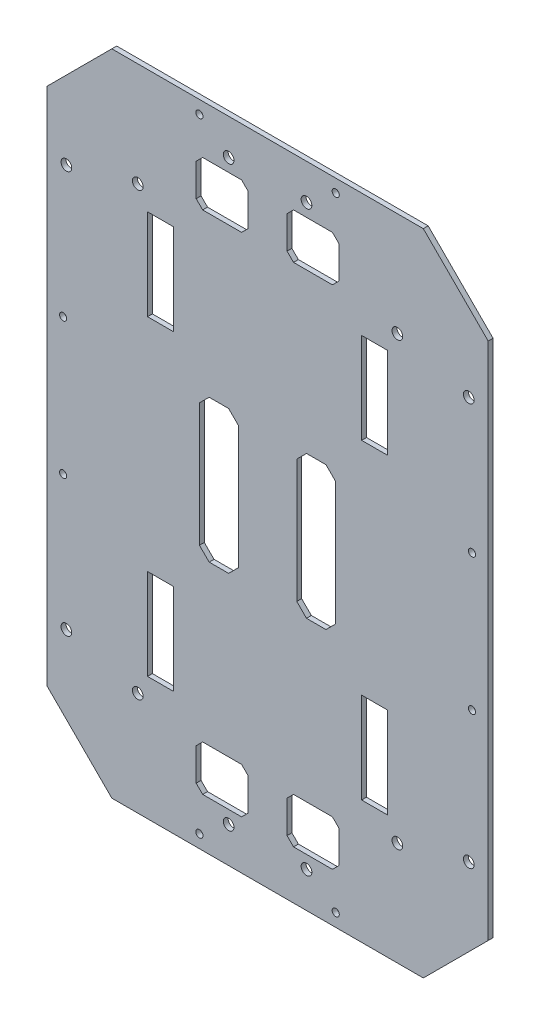
from build123d import *

# Parameters (mm, degrees)
SKETCH_1_R            = 1.65
SKETCH_1_W            = 8
SKETCH_1_H            = 28
EXTRUDE_401_DEPTH     = 1.5
SKETCH_3_R            = 1.1
CUT_EXTRUDE_482_DEPTH = 1.5


with BuildPart() as part:
    # 草图1 → Extrude 401 (new body)
    with BuildSketch(Plane.XY):
        Polygon((68, 80), (48, 100), (-48, 100), (-68, 80), (-68, -80), (-48, -100), (48, -100), (68, -80), align=None)
        with Locations((-62, -62)):
            Circle(SKETCH_1_R, mode=Mode.SUBTRACT)
        with Locations((-40, -68)):
            Circle(SKETCH_1_R, mode=Mode.SUBTRACT)
        with Locations((-12, -89)):
            Circle(SKETCH_1_R, mode=Mode.SUBTRACT)
        with Locations((-62, 62)):
            Circle(SKETCH_1_R, mode=Mode.SUBTRACT)
        with Locations((-40, 68)):
            Circle(SKETCH_1_R, mode=Mode.SUBTRACT)
        with Locations((-12, 89)):
            Circle(SKETCH_1_R, mode=Mode.SUBTRACT)
        with Locations((62, -62)):
            Circle(SKETCH_1_R, mode=Mode.SUBTRACT)
        with Locations((40, -68)):
            Circle(SKETCH_1_R, mode=Mode.SUBTRACT)
        with Locations((12, -89)):
            Circle(SKETCH_1_R, mode=Mode.SUBTRACT)
        with Locations((62, 62)):
            Circle(SKETCH_1_R, mode=Mode.SUBTRACT)
        with Locations((40, 68)):
            Circle(SKETCH_1_R, mode=Mode.SUBTRACT)
        with Locations((12, 89)):
            Circle(SKETCH_1_R, mode=Mode.SUBTRACT)
        with Locations((-33, -48)):
            Rectangle(SKETCH_1_W, SKETCH_1_H, mode=Mode.SUBTRACT)
        Polygon((-20, -85), (-8, -85), (-6, -83), (-6, -73), (-8, -71), (-20, -71), (-22, -73), (-22, -83), align=None, mode=Mode.SUBTRACT)
        with Locations((-33, 48)):
            Rectangle(SKETCH_1_W, SKETCH_1_H, mode=Mode.SUBTRACT)
        Polygon((-20, 71), (-8, 71), (-6, 73), (-6, 83), (-8, 85), (-20, 85), (-22, 83), (-22, 73), align=None, mode=Mode.SUBTRACT)
        with Locations((33, -48)):
            Rectangle(SKETCH_1_W, SKETCH_1_H, mode=Mode.SUBTRACT)
        Polygon((8, -85), (20, -85), (22, -83), (22, -73), (20, -71), (8, -71), (6, -73), (6, -83), align=None, mode=Mode.SUBTRACT)
        with Locations((33, 48)):
            Rectangle(SKETCH_1_W, SKETCH_1_H, mode=Mode.SUBTRACT)
        Polygon((8, 71), (20, 71), (22, 73), (22, 83), (20, 85), (8, 85), (6, 83), (6, 73), align=None, mode=Mode.SUBTRACT)
        Polygon((-18, -22), (-12, -22), (-9, -19), (-9, 19), (-12, 22), (-18, 22), (-21, 19), (-21, -19), align=None, mode=Mode.SUBTRACT)
        Polygon((12, -22), (18, -22), (21, -19), (21, 19), (18, 22), (12, 22), (9, 19), (9, -19), align=None, mode=Mode.SUBTRACT)
    extrude(amount=EXTRUDE_401_DEPTH)

    # 草图3 → Cut-Extrude 482 (cut)
    with BuildSketch(Plane.XY):
        with Locations((-63, -21)):
            Circle(SKETCH_3_R)
        with Locations((-21, -96)):
            Circle(SKETCH_3_R)
        with Locations((-63, 21)):
            Circle(SKETCH_3_R)
        with Locations((-21, 96)):
            Circle(SKETCH_3_R)
        with Locations((63, -21)):
            Circle(SKETCH_3_R)
        with Locations((21, -96)):
            Circle(SKETCH_3_R)
        with Locations((63, 21)):
            Circle(SKETCH_3_R)
        with Locations((21, 96)):
            Circle(SKETCH_3_R)
    extrude(amount=CUT_EXTRUDE_482_DEPTH, mode=Mode.SUBTRACT)


solid = part.part
